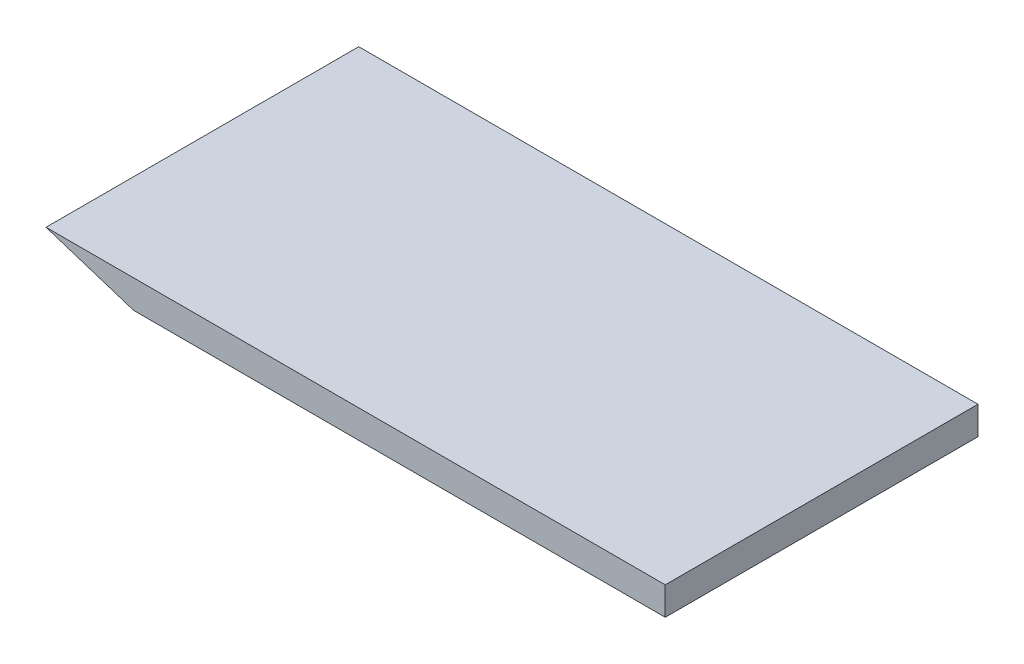
from build123d import *

# Parameters (mm, degrees)
BOSS_EXTRUDE1_DEPTH = 100


with BuildPart() as part:
    # Sketch1 → Boss-Extrude1 (new body)
    with BuildSketch(Plane.XY):
        Polygon((0, 0), (198, 0), (198, -9), (28, -9), align=None)
    extrude(amount=BOSS_EXTRUDE1_DEPTH)


solid = part.part
